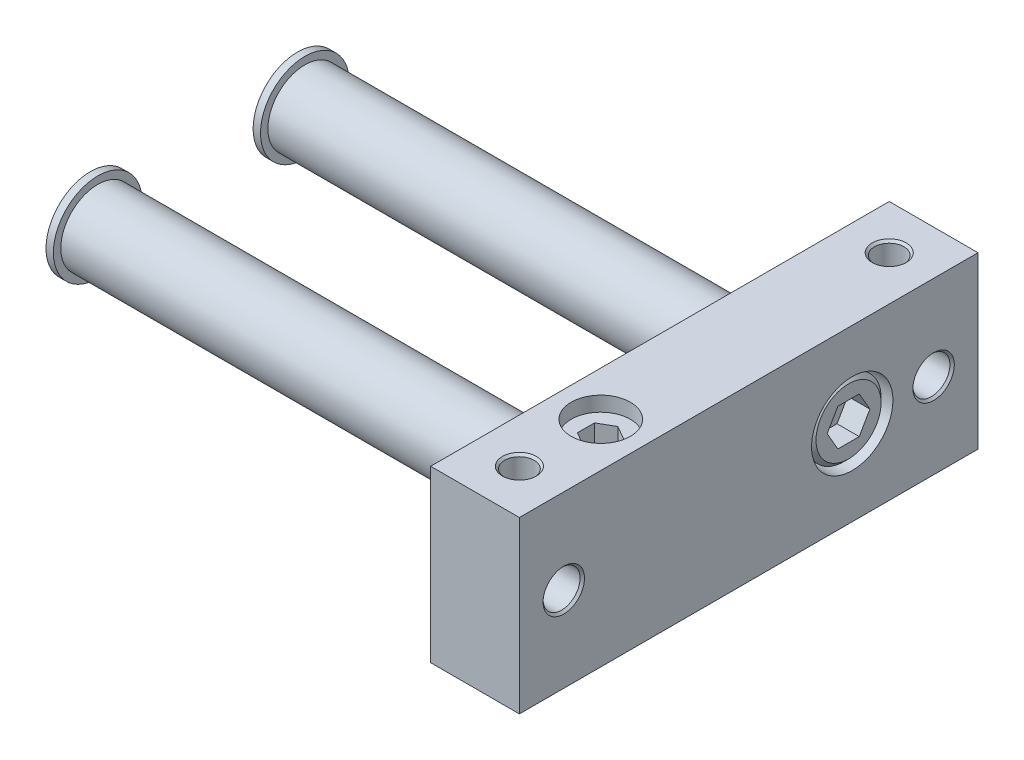
from build123d import *

# Parameters (mm, degrees)
PLATE_SKETCH_W               = 62
PLATE_SKETCH_H               = 23
PLATE_DEPTH                  = 12
TAPPED_HOLE_FACE_D           = 5
TAPPED_HOLE_FACE_CSINK_D     = 5.6
TAPPED_HOLE_FACE_CSINK_ANGLE = 90
RODS_DEPTH                   = 50
RODS_DEPTH_BACK              = 24
RODS_SKETCH_R                = 5
PISTON_SKETCH_R              = 6
PISTON_DEPTH                 = 1
TAPPED_HOLES_TOP_AT_2_COUNT  = 2
TAPPED_HOLES_TOP_AT_2_PITCH  = 50
SHCS_SEAT_SKETCH_R           = 5.5
SHCS_SEAT_DEPTH              = 6.5
SHCS_HEAD_SKETCH_R           = 5
SHCS_HEAD_DEPTH              = 6
SHCS_HEX_DEPTH               = 3
SHCS_CHAM_SIZE               = 0.6
SS_SEAT_SKETCH_R             = 4
SS_SEAT_DEPTH                = 2
SS_HEX_DEPTH                 = 4


with BuildPart() as part:
    # Plate_Sketch → Plate (new body)
    with BuildSketch(Plane(origin=(0, 0, 0), x_dir=(0, 0, -1), z_dir=(1, 0, 0))):
        Rectangle(PLATE_SKETCH_W, PLATE_SKETCH_H)
    extrude(amount=PLATE_DEPTH)

    # Tapped Hole Face (through all)
    with Locations(Plane(origin=(12, 0, 0), x_dir=(0, 0, -1), z_dir=(1, 0, 0))):
        with Locations((-25, 0), (25, 0)):
            CounterSinkHole(TAPPED_HOLE_FACE_D / 2, TAPPED_HOLE_FACE_CSINK_D / 2, counter_sink_angle=TAPPED_HOLE_FACE_CSINK_ANGLE)

    # Rods_Sketch → Rods (add, two sides: drawn at the far end of the back side and taken through both)
    with BuildSketch(Plane.ZY.offset(12).offset(-RODS_DEPTH_BACK)):
        with Locations((-14, 0)):
            Circle(RODS_SKETCH_R)
        with Locations(Location((14, 0, 0), (0, 0, 180))):
            Circle(RODS_SKETCH_R)
    extrude(amount=RODS_DEPTH + RODS_DEPTH_BACK)

    # Piston_Sketch → Piston (add)
    with BuildSketch(Plane.ZY.offset(62)):
        with Locations((-14, 0)):
            Circle(PISTON_SKETCH_R)
        with Locations((14, 0)):
            Circle(PISTON_SKETCH_R)
    extrude(amount=PISTON_DEPTH)

    # Tapped Holes Top Profile → Tapped Holes Top (revolve, cut)
    with BuildSketch(Plane(origin=(6, 11.5, -25), x_dir=(0, 0, 1), z_dir=(1, 0, 0))):
        Polygon((0, 0), (0, 6.499755867), (1.7, 6.2), (1.7, 6), (2, 6), (2, 0.3), (2.3, 0), align=None)
    tapped_holes_top = revolve(axis=Axis((6, 17.85, -25), (0, -1, 0)), mode=Mode.SUBTRACT)

    # Tapped Holes Top at 2: Tapped Holes Top ×2
    with Locations(*[(0, 0, i * TAPPED_HOLES_TOP_AT_2_PITCH) for i in range(1, TAPPED_HOLES_TOP_AT_2_COUNT)]):
        add(tapped_holes_top, mode=Mode.SUBTRACT)

    # Tapped Holes Top Mirror: Tapped Holes Top across plane
    add(tapped_holes_top.mirror(Plane.ZX), mode=Mode.SUBTRACT)

    # Tapped Holes Top Mirror copy 1 sketch → Tapped Holes Top Mirror copy 1 (revolve, cut)
    with BuildSketch(Plane(origin=(6, -11.5, 25), x_dir=(0, 0, 1), z_dir=(1, 0, 0))):
        Polygon((0, 0), (0, -6.499755867), (1.7, -6.2), (1.7, -6), (2, -6), (2, -0.3), (2.3, 0), align=None)
    revolve(axis=Axis((6, -17.85, 25), (0, -1, 0)), mode=Mode.SUBTRACT)

    # SHCS Seat_Sketch → SHCS Seat (cut)
    with BuildSketch(Plane(origin=(12, 0, 0), x_dir=(0, 0, -1), z_dir=(1, 0, 0))):
        with Locations((14, 0)):
            Circle(SHCS_SEAT_SKETCH_R)
    extrude(amount=-SHCS_SEAT_DEPTH, mode=Mode.SUBTRACT)

    # SHCS Head_Sketch → SHCS Head (add)
    with BuildSketch(Plane(origin=(5.5, 0, 0), x_dir=(0, 0, -1), z_dir=(1, 0, 0))):
        with Locations(Location((14, 0, 0), (0, 0, 180))):
            Circle(SHCS_HEAD_SKETCH_R)
    extrude(amount=SHCS_HEAD_DEPTH)

    # SHCS Hex_Sketch → SHCS Hex (cut)
    with BuildSketch(Plane(origin=(11.5, 0, 0), x_dir=(0, 0, -1), z_dir=(1, 0, 0))):
        Polygon((15.443375673, -2.5), (16.886751346, 0), (15.443375673, 2.5), (12.556624327, 2.5), (11.113248654, 0), (12.556624327, -2.5), align=None)
    extrude(amount=-SHCS_HEX_DEPTH, mode=Mode.SUBTRACT)

    # SHCS Cham
    shcs_cham_edges = [part.edges().sort_by_distance(p)[0] for p in [
        (11.5, 0, -19),
    ]]
    chamfer(shcs_cham_edges, length=SHCS_CHAM_SIZE)

    # SS Seat_Sketch → SS Seat (cut)
    with BuildSketch(Plane(origin=(0, 11.5, 0), x_dir=(-1, 0, 0), z_dir=(0, 1, 0))):
        with Locations(Location((-6, 14, 0), (0, 0, 90))):
            Circle(SS_SEAT_SKETCH_R)
    extrude(amount=-SS_SEAT_DEPTH, mode=Mode.SUBTRACT)

    # SS Hex_Sketch → SS Hex (cut)
    with BuildSketch(Plane(origin=(0, 9.5, 0), x_dir=(-1, 0, 0), z_dir=(0, 1, 0))):
        Polygon((-8, 12.845299462), (-6, 11.690598923), (-4, 12.845299462), (-4, 15.154700538), (-6, 16.309401077), (-8, 15.154700538), align=None)
    extrude(amount=-SS_HEX_DEPTH, mode=Mode.SUBTRACT)


solid = part.part
